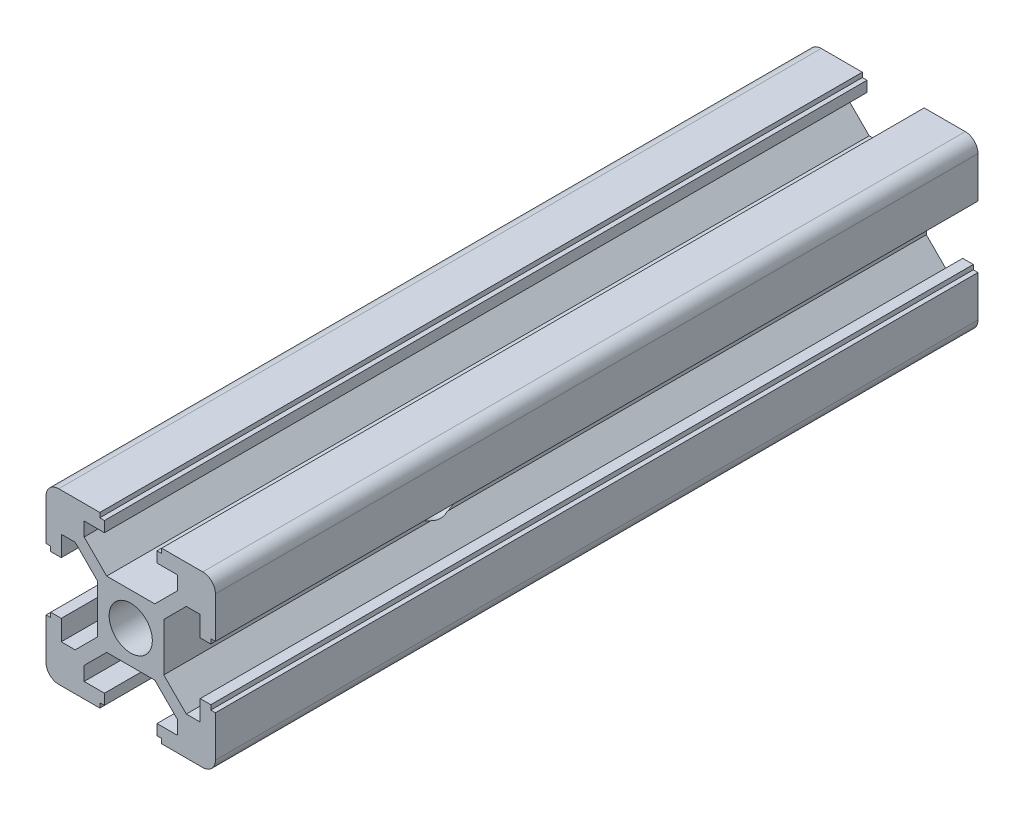
from build123d import *

# Parameters (mm, degrees)
SKETCH_2_R          = 2.55
EXTRUDE_1_DEPTH     = 90
SKETCH_3_R          = 3
CUT_EXTRUDE_1_DEPTH = 93.736184955


with BuildPart() as part:
    # 草图2 → 凸台-拉伸1 (new body)
    with BuildSketch(Plane.XY):
        with BuildLine():
            Line((-3.9, 2.839339828), (-6.560660172, 5.5))
            Line((-6.560660172, 5.5), (-8.2, 5.5))
            Line((-8.2, 5.5), (-8.2, 3.1))
            Line((-8.2, 3.1), (-9.45, 3.1))
            Line((-9.45, 3.1), (-9.45, 3.65))
            Line((-9.45, 3.65), (-10, 3.65))
            Line((-10, 3.65), (-10, 8.5))
            ThreePointArc((-10, 8.5), (-9.560660172, 9.560660172), (-8.5, 10))
            Line((-8.5, 10), (-3.65, 10))
            Line((-3.65, 10), (-3.65, 9.45))
            Line((-3.65, 9.45), (-3.1, 9.45))
            Line((-3.1, 9.45), (-3.1, 8.2))
            Line((-3.1, 8.2), (-5.5, 8.2))
            Line((-5.5, 8.2), (-5.5, 6.560660172))
            Line((-5.5, 6.560660172), (-2.839339828, 3.9))
            Line((-2.839339828, 3.9), (2.839339828, 3.9))
            Line((2.839339828, 3.9), (5.5, 6.560660172))
            Line((5.5, 6.560660172), (5.5, 8.2))
            Line((5.5, 8.2), (3.1, 8.2))
            Line((3.1, 8.2), (3.1, 9.45))
            Line((3.1, 9.45), (3.65, 9.45))
            Line((3.65, 9.45), (3.65, 10))
            Line((3.65, 10), (8.5, 10))
            ThreePointArc((8.5, 10), (9.560660172, 9.560660172), (10, 8.5))
            Line((10, 8.5), (10, 3.65))
            Line((10, 3.65), (9.45, 3.65))
            Line((9.45, 3.65), (9.45, 3.1))
            Line((9.45, 3.1), (8.2, 3.1))
            Line((8.2, 3.1), (8.2, 5.5))
            Line((8.2, 5.5), (6.560660172, 5.5))
            Line((6.560660172, 5.5), (3.9, 2.839339828))
            Line((3.9, 2.839339828), (3.9, -2.839339828))
            Line((3.9, -2.839339828), (6.560660172, -5.5))
            Line((6.560660172, -5.5), (8.2, -5.5))
            Line((8.2, -5.5), (8.2, -3.1))
            Line((8.2, -3.1), (9.45, -3.1))
            Line((9.45, -3.1), (9.45, -3.65))
            Line((9.45, -3.65), (10, -3.65))
            Line((10, -3.65), (10, -8.5))
            ThreePointArc((10, -8.5), (9.560660172, -9.560660172), (8.5, -10))
            Line((8.5, -10), (3.65, -10))
            Line((3.65, -10), (3.65, -9.45))
            Line((3.65, -9.45), (3.1, -9.45))
            Line((3.1, -9.45), (3.1, -8.2))
            Line((3.1, -8.2), (5.5, -8.2))
            Line((5.5, -8.2), (5.5, -6.560660172))
            Line((5.5, -6.560660172), (2.839339828, -3.9))
            Line((2.839339828, -3.9), (-2.839339828, -3.9))
            Line((-2.839339828, -3.9), (-5.5, -6.560660172))
            Line((-5.5, -6.560660172), (-5.5, -8.2))
            Line((-5.5, -8.2), (-3.1, -8.2))
            Line((-3.1, -8.2), (-3.1, -9.45))
            Line((-3.1, -9.45), (-3.65, -9.45))
            Line((-3.65, -9.45), (-3.65, -10))
            Line((-3.65, -10), (-8.5, -10))
            ThreePointArc((-8.5, -10), (-9.560660172, -9.560660172), (-10, -8.5))
            Line((-10, -8.5), (-10, -3.65))
            Line((-10, -3.65), (-9.45, -3.65))
            Line((-9.45, -3.65), (-9.45, -3.1))
            Line((-9.45, -3.1), (-8.2, -3.1))
            Line((-8.2, -3.1), (-8.2, -5.5))
            Line((-8.2, -5.5), (-6.560660172, -5.5))
            Line((-6.560660172, -5.5), (-3.9, -2.839339828))
            Line((-3.9, -2.839339828), (-3.9, 2.839339828))
        make_face()
        with Locations(Location((0, 0, 0), (0, 0, 180))):
            Circle(SKETCH_2_R, mode=Mode.SUBTRACT)
    extrude(amount=EXTRUDE_1_DEPTH)

    # 草图3 → 切除-拉伸1 (cut, through all)
    with BuildSketch(Plane(origin=(10, 0, 0), x_dir=(0, 0, -1), z_dir=(1, 0, 0))):
        with Locations(Location((-57.5, 0, 0), (0, 0, 71.16400384))):
            Circle(SKETCH_3_R)
        with Locations((-302.5, 0)):
            Circle(SKETCH_3_R)
    extrude(amount=-CUT_EXTRUDE_1_DEPTH, mode=Mode.SUBTRACT)


solid = part.part
